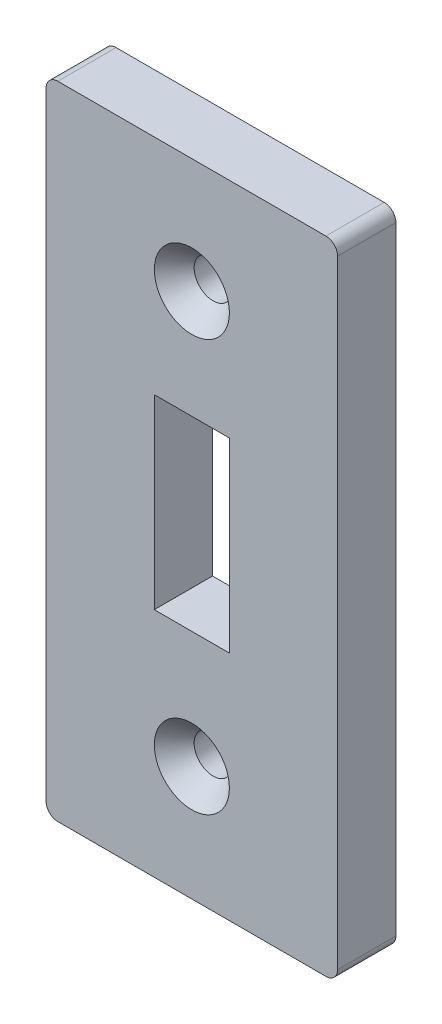
from build123d import *

# Parameters (mm, degrees)
SKETCH1_W                                        = 50
SKETCH1_H                                        = 110
BOSS_EXTRUDE1_DEPTH                              = 10
CSK_FOR_1_4_FLAT_HEAD_MACHINE_SCREW1_D           = 6.5278
CSK_FOR_1_4_FLAT_HEAD_MACHINE_SCREW1_CSINK_D     = 12.8778
CSK_FOR_1_4_FLAT_HEAD_MACHINE_SCREW1_CSINK_ANGLE = 82
FILLET1_R                                        = 2


with BuildPart() as part:
    # Sketch1 → Boss-Extrude1 (new body)
    with BuildSketch(Plane.XY):
        with Locations((0.542522126, -0.271261063)):
            Rectangle(SKETCH1_W, SKETCH1_H)
        Polygon((0.542522126, 16.44340804), (6.992522126, 16.44340804), (6.992522126, -15.50659196), (0.542522126, -15.50659196), (-5.907477874, -15.50659196), (-5.907477874, 16.44340804), align=None, mode=Mode.SUBTRACT)
    extrude(amount=BOSS_EXTRUDE1_DEPTH)

    # CSK for 1/4 Flat Head Machine Screw1 (through all)
    with Locations(Plane.XY.offset(10)):
        with Locations((0.542522126, -35.581261063), (0.542522126, 35.038738937)):
            CounterSinkHole(CSK_FOR_1_4_FLAT_HEAD_MACHINE_SCREW1_D / 2, CSK_FOR_1_4_FLAT_HEAD_MACHINE_SCREW1_CSINK_D / 2, counter_sink_angle=CSK_FOR_1_4_FLAT_HEAD_MACHINE_SCREW1_CSINK_ANGLE)

    # Fillet1
    fillet1_edges = [part.edges().sort_by_distance(p)[0] for p in [
        (-24.457477874, 54.728738937, 5),
        (25.542522126, 54.728738937, 5),
        (25.542522126, -55.271261063, 5),
        (-24.457477874, -55.271261063, 5),
    ]]
    fillet(fillet1_edges, radius=FILLET1_R)


solid = part.part
